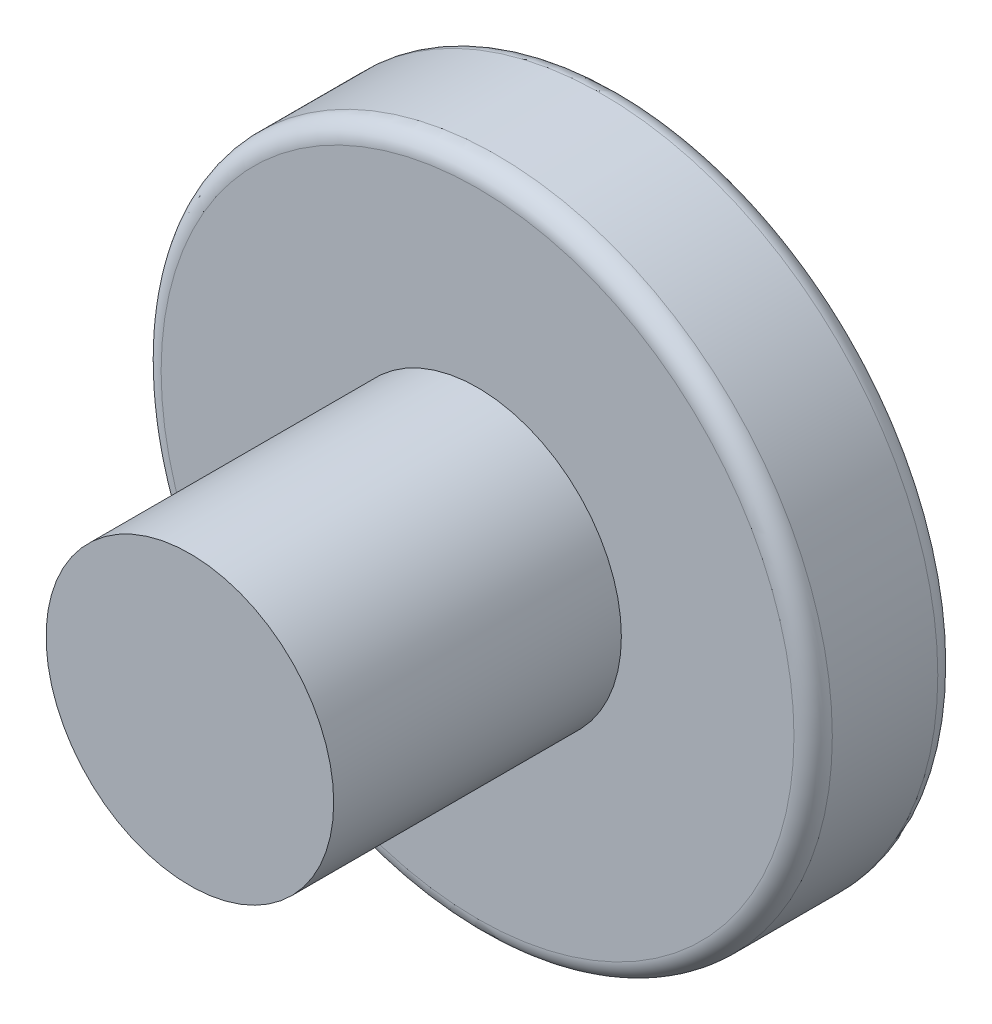
from build123d import *

# Parameters (mm, degrees)
SKETCH_1_R          = 3.5
EXTRUDE_1_DEPTH     = 1.5
SKETCH_2_R          = 1.5
EXTRUDE_2_DEPTH     = 3
FILLET_1_R          = 0.2
CUT_EXTRUDE_1_DEPTH = 1.5


with BuildPart() as part:
    # 草图1 → 凸台-拉伸1 (new body)
    with BuildSketch(Plane.XY):
        Circle(SKETCH_1_R)
    extrude(amount=EXTRUDE_1_DEPTH)

    # 草图2 → 凸台-拉伸2 (add)
    with BuildSketch(Plane.XY.offset(1.5)):
        Circle(SKETCH_2_R)
    extrude(amount=EXTRUDE_2_DEPTH)

    # 圆角1
    fillet_1_edges = [part.edges().sort_by_distance(p)[0] for p in [
        (-3.5, 0, 0),
        (-3.5, 0, 1.5),
    ]]
    fillet(fillet_1_edges, radius=FILLET_1_R)

    # 草图3 → 切除-拉伸1 (cut)
    with BuildSketch(Plane(origin=(0, 0, 0), x_dir=(-1, 0, 0), z_dir=(0, 0, -1))):
        Polygon((1.154700538, 0), (0.577350269, 1), (-0.577350269, 1), (-1.154700538, 0), (-0.577350269, -1), (0.577350269, -1), align=None)
    extrude(amount=-CUT_EXTRUDE_1_DEPTH, mode=Mode.SUBTRACT)


solid = part.part
